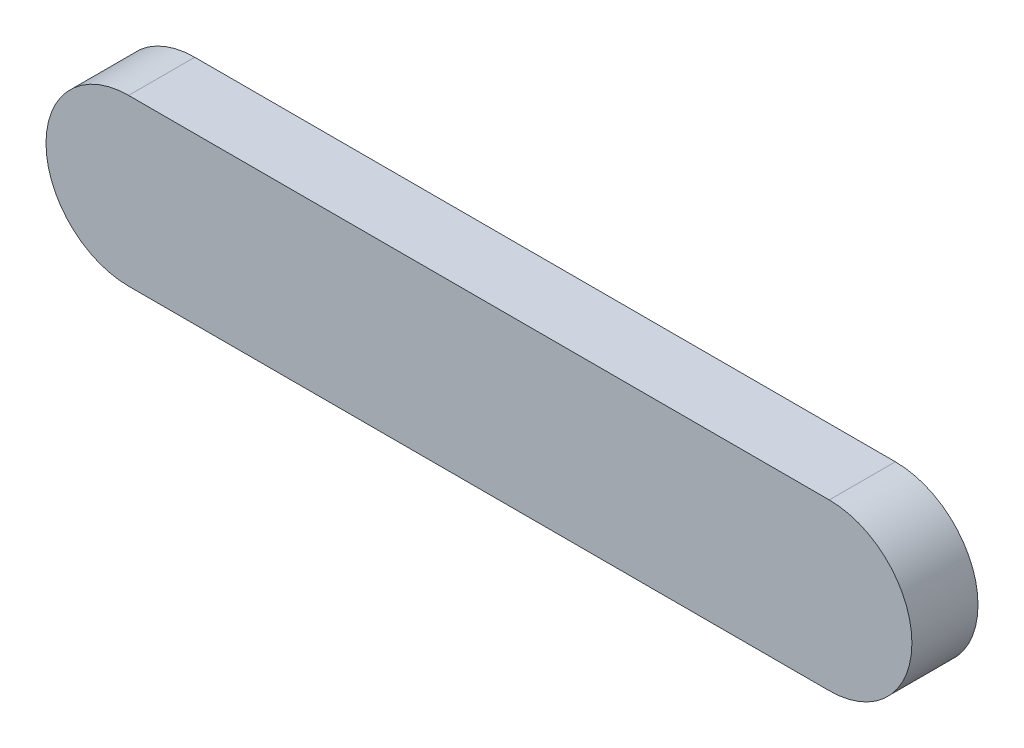
from build123d import *

# Parameters (mm, degrees)
EXTRUDE_1_DEPTH = 20


with BuildPart() as part:
    # 草图1 → 凸台-拉伸1 (new body)
    with BuildSketch(Plane.XY):
        with BuildLine():
            Line((0, 25), (212, 25))
            ThreePointArc((212, 25), (237, 0), (212, -25))
            Line((212, -25), (0, -25))
            ThreePointArc((0, -25), (-25, 0), (0, 25))
        make_face()
    extrude(amount=EXTRUDE_1_DEPTH)


solid = part.part
